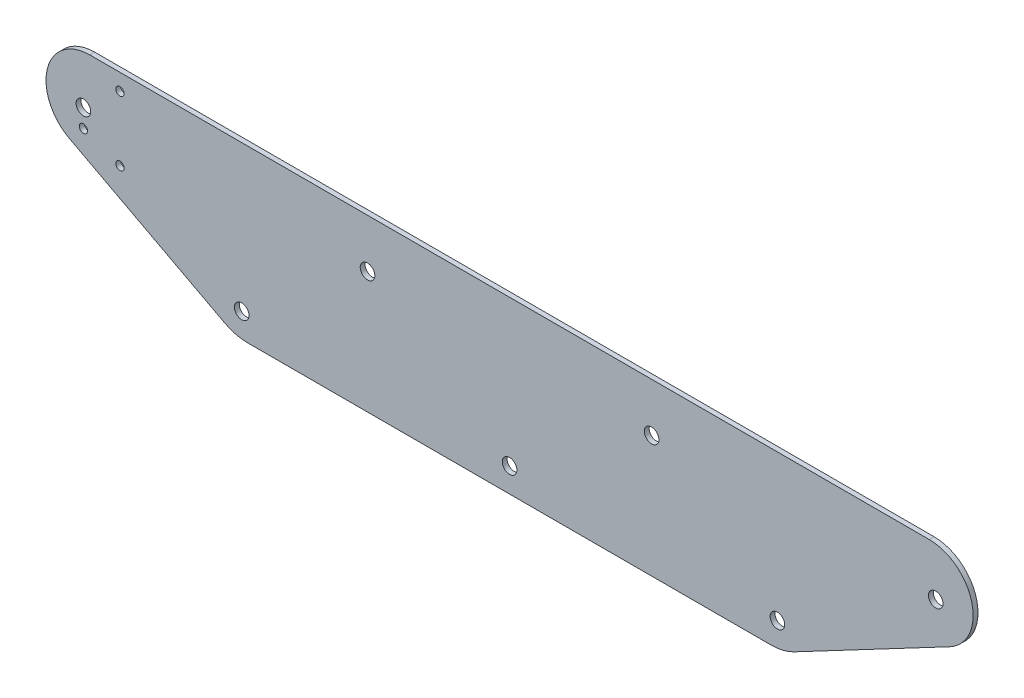
from build123d import *

# Parameters (mm, degrees)
ESQUISSE1_R        = 3
BOSS_EXTRU_1_DEPTH = 2
CONG_1_R           = 18
CONG_2_R           = 20
D_GAGEMENT_M31_D   = 3.4


with BuildPart() as part:
    # Esquisse1 → Boss.-Extru.1 (new body)
    with BuildSketch(Plane.XY):
        Polygon((-244.958991582, 40), (-110, 40), (110, 40), (244.958991582, 40), (112.479495791, -30), (-112.479495791, -30), align=None)
        with Locations((-175, 20)):
            Circle(ESQUISSE1_R, mode=Mode.SUBTRACT)
        with Locations((-110, -20)):
            Circle(ESQUISSE1_R, mode=Mode.SUBTRACT)
        with Locations((110, -20)):
            Circle(ESQUISSE1_R, mode=Mode.SUBTRACT)
        with Locations((175, 20)):
            Circle(ESQUISSE1_R, mode=Mode.SUBTRACT)
        with Locations((0, -20)):
            Circle(ESQUISSE1_R, mode=Mode.SUBTRACT)
        with Locations((-58.333333333, 20)):
            Circle(ESQUISSE1_R, mode=Mode.SUBTRACT)
        with Locations((58.333333333, 20)):
            Circle(ESQUISSE1_R, mode=Mode.SUBTRACT)
    extrude(amount=BOSS_EXTRU_1_DEPTH)

    # Congé1
    cong_1_edges = [part.edges().sort_by_distance(p)[0] for p in [
        (-244.958991582, 40, 1),
        (244.958991582, 40, 1),
    ]]
    fillet(cong_1_edges, radius=CONG_1_R)

    # Congé2
    cong_2_edges = [part.edges().sort_by_distance(p)[0] for p in [
        (112.479495791, -30, 1),
        (-112.479495791, -30, 1),
    ]]
    fillet(cong_2_edges, radius=CONG_2_R)

    # Dégagement M31 (through all)
    with Locations(Plane(origin=(0, 0, 0), x_dir=(-1, 0, 0), z_dir=(0, 0, -1))):
        with Locations((160, 33.228756555), (175, 12.5), (160, 6.771243445)):
            Hole(D_GAGEMENT_M31_D / 2)


solid = part.part
